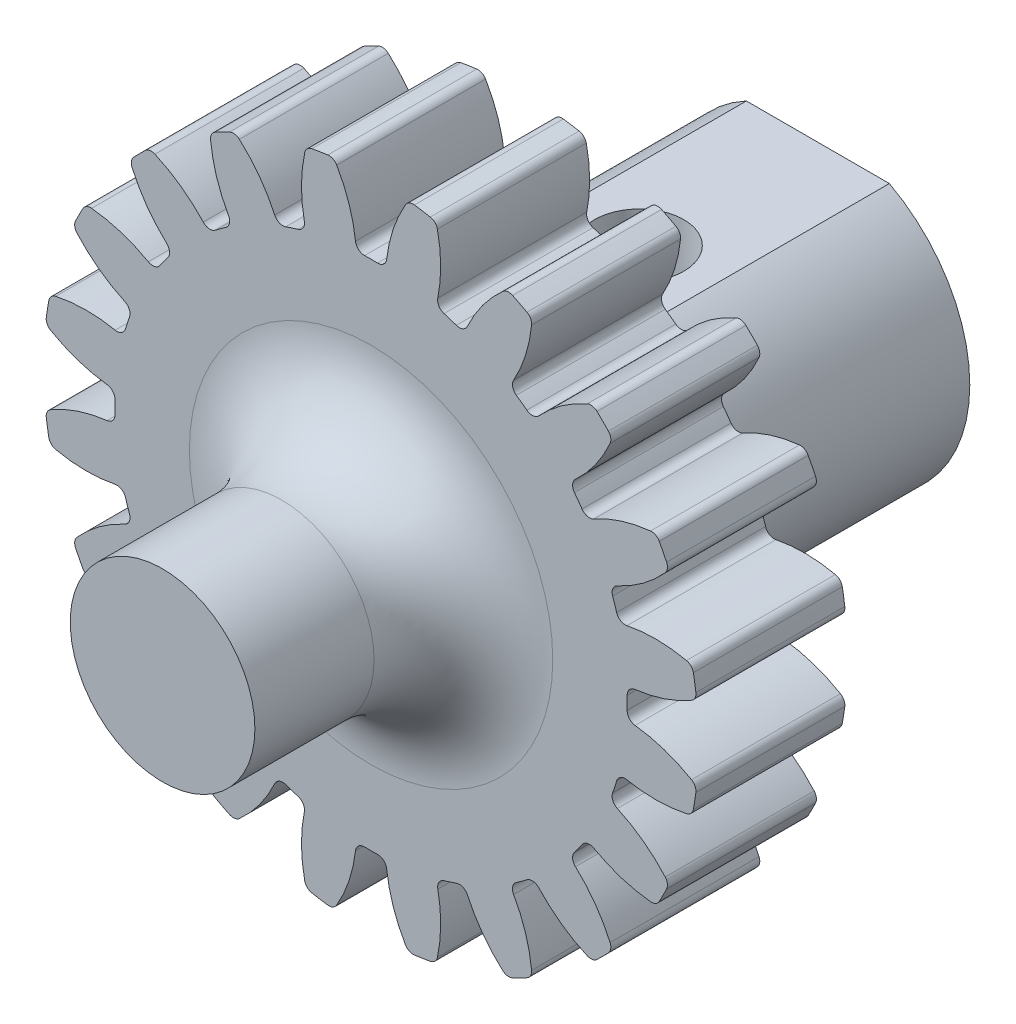
from build123d import *

# Parameters (mm, degrees)
SKETCH1_R                = 11
BOSS_EXTRUDE1_DEPTH      = 2.5
CUT_EXTRUDE1_DEPTH       = 17.340134638
FILLET1_R                = 0.3
CIRPATTERN1_COUNT        = 20
FILLET1_OF_CIRPATTERN1_R = 0.3
CUT_EXTRUDE2_DEPTH       = 17.213948476
CUT_EXTRUDE2_DEPTH_BACK  = 17.213948476
BACK_START               = 10
BACK_SHAFT_DEPTH         = 10
SKETCH12_R               = 1.5
CUT_EXTRUDE4_DEPTH       = 20
FRONT_SHAFT_DEPTH        = 7
FRONT_SHAFT_DEPTH_BACK   = 2
SKETCH15_R               = 3.1
FILLET3_R                = 3
SKETCH16_R               = 3.2
CUT_EXTRUDE5_DEPTH       = 2
CUT_EXTRUDE15_DEPTH      = 11
FILLET4_R                = 1


with BuildPart() as part:
    # Sketch1 → Boss-Extrude1 (new, symmetric)
    with BuildSketch(Plane.XY):
        Circle(SKETCH1_R)
    extrude(amount=BOSS_EXTRUDE1_DEPTH, both=True)

    # Sketch3 → Cut-Extrude1 (cut, symmetric)
    with BuildSketch(Plane.XY.offset(2.5)):
        with BuildLine():
            ThreePointArc((-2.003514702, 11.831564936), (-0.942497529, 10.351642818), (-0.498977652, 8.585512291))
            ThreePointArc((-0.498977652, 8.585512291), (0, 8.6), (0.498977652, 8.585512291))
            ThreePointArc((0.498977652, 8.585512291), (0.942497529, 10.351642818), (2.003514702, 11.831564936))
            ThreePointArc((2.003514702, 11.831564936), (0, 12), (-2.003514702, 11.831564936))
        make_face()
    cut_extrude1 = extrude(amount=CUT_EXTRUDE1_DEPTH, both=True, mode=Mode.SUBTRACT)

    # Fillet1
    fillet1_edges = [part.edges().sort_by_distance(p)[0] for p in [
        (-0.498977652, 8.585512291, 0),
        (0.498977652, 8.585512291, 0),
        (1.258371443, 10.927785746, 0),
        (-1.258371443, 10.927785746, 0),
    ]]
    fillet(fillet1_edges, radius=FILLET1_R)

    # CirPattern1: Cut-Extrude1 ×20 about axis
    cirpattern1_axis = Axis((0, 0, 0), (0, 0, 1))
    for i in range(1, CIRPATTERN1_COUNT):
        add(cut_extrude1.rotate(cirpattern1_axis, i * 360 / CIRPATTERN1_COUNT), mode=Mode.SUBTRACT)

    # Fillet1 of CirPattern1
    fillet1_of_cirpattern1_edges = [part.edges().sort_by_distance(p)[0] for p in [
        (-3.12762515, 8.011114836, 0),
        (-2.178513256, 8.319499984, 0),
        (-2.180089146, 10.781800004, 0),
        (-4.573653867, 10.004083681, 0),
        (-5.450118908, 6.652533644, 0),
        (-4.642756108, 7.239117054, 0),
        (-5.405147419, 9.580416555, 0),
        (-7.441235184, 8.101112203, 0),
        (-7.239117054, 4.642756108, 0),
        (-6.652533644, 5.450118908, 0),
        (-8.101112203, 7.441235184, 0),
        (-9.580416555, 5.405147419, 0),
        (-8.319499984, 2.178513256, 0),
        (-8.011114836, 3.12762515, 0),
        (-10.004083681, 4.573653867, 0),
        (-10.781800004, 2.180089146, 0),
        (-8.585512291, -0.498977652, 0),
        (-8.585512291, 0.498977652, 0),
        (-10.927785746, 1.258371443, 0),
        (-10.927785746, -1.258371443, 0),
        (-8.011114836, -3.12762515, 0),
        (-8.319499984, -2.178513256, 0),
        (-10.781800004, -2.180089146, 0),
        (-10.004083681, -4.573653867, 0),
        (-6.652533644, -5.450118908, 0),
        (-7.239117054, -4.642756108, 0),
        (-9.580416555, -5.405147419, 0),
        (-8.101112203, -7.441235184, 0),
        (-4.642756108, -7.239117054, 0),
        (-5.450118908, -6.652533644, 0),
        (-7.441235184, -8.101112203, 0),
        (-5.405147419, -9.580416555, 0),
        (-2.178513256, -8.319499984, 0),
        (-3.12762515, -8.011114836, 0),
        (-4.573653867, -10.004083681, 0),
        (-2.180089146, -10.781800004, 0),
        (0.498977652, -8.585512291, 0),
        (-0.498977652, -8.585512291, 0),
        (-1.258371443, -10.927785746, 0),
        (1.258371443, -10.927785746, 0),
        (3.12762515, -8.011114836, 0),
        (2.178513256, -8.319499984, 0),
        (2.180089146, -10.781800004, 0),
        (4.573653867, -10.004083681, 0),
        (5.450118908, -6.652533644, 0),
        (4.642756108, -7.239117054, 0),
        (5.405147419, -9.580416555, 0),
        (7.441235184, -8.101112203, 0),
        (7.239117054, -4.642756108, 0),
        (6.652533644, -5.450118908, 0),
        (8.101112203, -7.441235184, 0),
        (9.580416555, -5.405147419, 0),
        (8.319499984, -2.178513256, 0),
        (8.011114836, -3.12762515, 0),
        (10.004083681, -4.573653867, 0),
        (10.781800004, -2.180089146, 0),
        (8.585512291, 0.498977652, 0),
        (8.585512291, -0.498977652, 0),
        (10.927785746, -1.258371443, 0),
        (10.927785746, 1.258371443, 0),
        (8.011114836, 3.12762515, 0),
        (8.319499984, 2.178513256, 0),
        (10.781800004, 2.180089146, 0),
        (10.004083681, 4.573653867, 0),
        (6.652533644, 5.450118908, 0),
        (7.239117054, 4.642756108, 0),
        (9.580416555, 5.405147419, 0),
        (8.101112203, 7.441235184, 0),
        (4.642756108, 7.239117054, 0),
        (5.450118908, 6.652533644, 0),
        (7.441235184, 8.101112203, 0),
        (5.405147419, 9.580416555, 0),
        (2.178513256, 8.319499984, 0),
        (3.12762515, 8.011114836, 0),
        (4.573653867, 10.004083681, 0),
        (2.180089146, 10.781800004, 0),
    ]]
    fillet(fillet1_of_cirpattern1_edges, radius=FILLET1_OF_CIRPATTERN1_R)

    # Sketch4 → Cut-Extrude2 (cut, two sides: drawn at the far end of the back side and taken through both)
    with BuildSketch(Plane.XY.offset(2.5).offset(-CUT_EXTRUDE2_DEPTH_BACK)):
        with BuildLine():
            Line((-1.833030278, 2.5), (1.833030278, 2.5))
            ThreePointArc((1.833030278, 2.5), (0, -3.1), (-1.833030278, 2.5))
        make_face()
    extrude(amount=CUT_EXTRUDE2_DEPTH + CUT_EXTRUDE2_DEPTH_BACK, mode=Mode.SUBTRACT)

    # Sketch11 → Back Shaft (add)
    with BuildSketch(Plane(origin=(0, 0, -2.5), x_dir=(-1, 0, 0), z_dir=(0, 0, -1)).offset(BACK_START)):
        with BuildLine():
            Line((2.4, 4.5), (-2.4, 4.5))
            ThreePointArc((-2.4, 4.5), (0, -5.1), (2.4, 4.5))
        make_face()
        with BuildLine():
            Line((-1.833030278, 2.5), (1.833030278, 2.5))
            ThreePointArc((1.833030278, 2.5), (0, -3.1), (-1.833030278, 2.5))
        make_face(mode=Mode.SUBTRACT)
    extrude(amount=-BACK_SHAFT_DEPTH)

    # Sketch12 → Cut-Extrude4 (cut)
    with BuildSketch(Plane(origin=(0, 4.5, 0), x_dir=(1, 0, 0), z_dir=(0, 1, 0))):
        with Locations(Location((0, 6.5, 0), (0, 0, 270))):
            Circle(SKETCH12_R)
    extrude(amount=-CUT_EXTRUDE4_DEPTH, mode=Mode.SUBTRACT)

    # Sketch15 → Front Shaft (add, two sides: drawn at the far end of the back side and taken through both)
    with BuildSketch(Plane.XY.offset(2.5).offset(-FRONT_SHAFT_DEPTH_BACK)):
        Circle(SKETCH15_R)
    extrude(amount=FRONT_SHAFT_DEPTH + FRONT_SHAFT_DEPTH_BACK)

    # Fillet3
    fillet3_edges = [part.edges().sort_by_distance(p)[0] for p in [
        (-3.1, 0, 2.5),
    ]]
    fillet(fillet3_edges, radius=FILLET3_R)

    # Sketch16 → Cut-Extrude5 (cut)
    with BuildSketch(Plane(origin=(0, 0, -12.5), x_dir=(-1, 0, 0), z_dir=(0, 0, -1))):
        Circle(SKETCH16_R)
    extrude(amount=-CUT_EXTRUDE5_DEPTH, mode=Mode.SUBTRACT)

    # Sketch17 → Cut-Extrude15 (cut)
    with BuildSketch(Plane(origin=(0, 0, -10.5), x_dir=(-1, 0, 0), z_dir=(0, 0, -1))):
        with BuildLine():
            ThreePointArc((1.833030278, 2.5), (0, -3.1), (-1.833030278, 2.5))
            Line((-1.833030278, 2.5), (-1.997498436, 2.5))
            ThreePointArc((-1.997498436, 2.5), (-1.387084173, -2.883747128), (3.2, 0))
            ThreePointArc((3.2, 0), (2.883747128, 1.387084173), (1.997498436, 2.5))
            Line((1.997498436, 2.5), (1.833030278, 2.5))
        make_face()
        with BuildLine():
            ThreePointArc((1.833030278, 2.5), (0, -3.1), (-1.833030278, 2.5))
            Line((-1.833030278, 2.5), (1.833030278, 2.5))
        make_face()
    extrude(amount=-CUT_EXTRUDE15_DEPTH, mode=Mode.SUBTRACT)

    # Fillet4
    fillet4_edges = [part.edges().sort_by_distance(p)[0] for p in [
        (0, -5.1, -2.5),
    ]]
    fillet(fillet4_edges, radius=FILLET4_R)


solid = part.part
